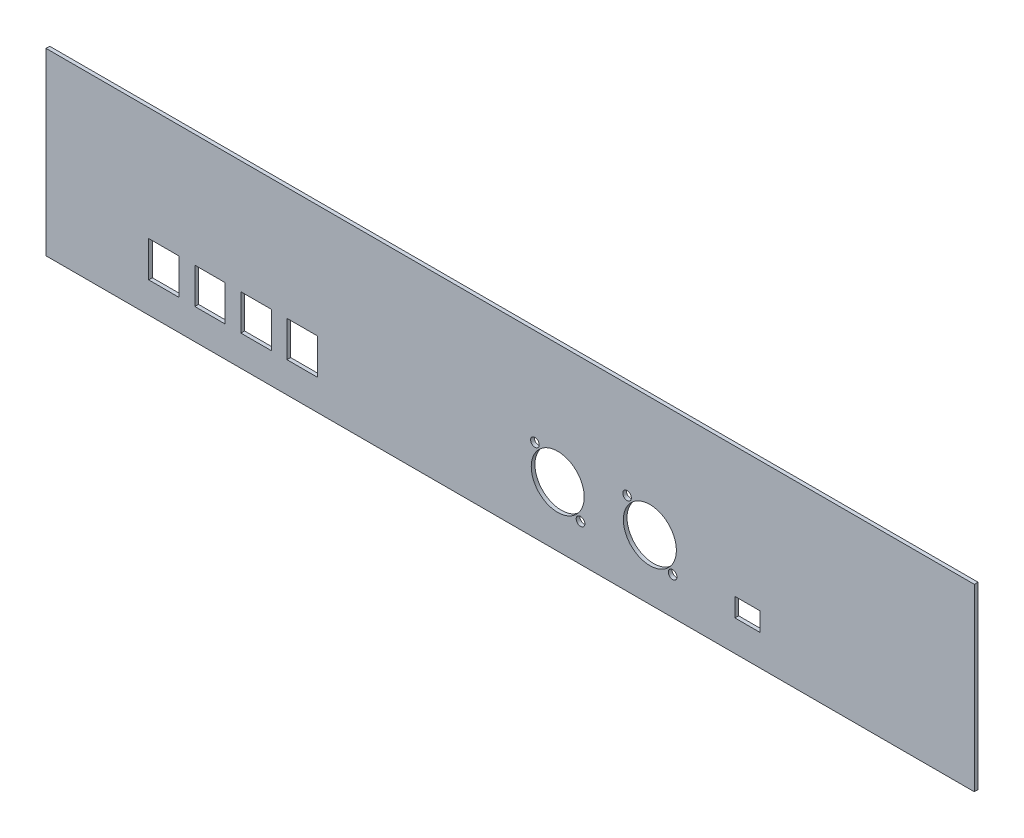
from build123d import *

# Parameters (mm, degrees)
PANEL_W             = 403
PANEL_H             = 78
BOSS_EXTRUDE1_DEPTH = 1.6
XLR4_R              = 11.5
XLR4_R_2            = 1.875
CUT_EXTRUDE2_DEPTH  = 1.6
RJ11_W              = 13.2
RJ11_H              = 15.55
CUT_EXTRUDE3_DEPTH  = 1.6
DC_PORT_W           = 10.85
DC_PORT_H           = 8.1
CUT_EXTRUDE4_DEPTH  = 1.6


with BuildPart() as part:
    # Panel → Boss-Extrude1 (new body)
    with BuildSketch(Plane.XY):
        with Locations((201.5, 39)):
            Rectangle(PANEL_W, PANEL_H)
    extrude(amount=BOSS_EXTRUDE1_DEPTH)

    # XLR4 → Cut-Extrude2 (cut)
    with BuildSketch(Plane.XY):
        with Locations(Location((222.15, 26.1, 0), (0, 0, 180))):
            Circle(XLR4_R)
        with Locations(Location((212.25, 36, 0), (0, 0, 180))):
            Circle(XLR4_R_2)
        with Locations(Location((232.05, 16.2, 0), (0, 0, 180))):
            Circle(XLR4_R_2)
        with Locations(Location((262.15, 26.1, 0), (0, 0, 180))):
            Circle(XLR4_R)
        with Locations(Location((252.25, 36, 0), (0, 0, 180))):
            Circle(XLR4_R_2)
        with Locations(Location((272.05, 16.2, 0), (0, 0, 180))):
            Circle(XLR4_R_2)
    extrude(amount=CUT_EXTRUDE2_DEPTH, mode=Mode.SUBTRACT)

    # RJ11 → Cut-Extrude3 (cut)
    with BuildSketch(Plane.XY):
        with Locations((71.2, 21.025)):
            Rectangle(RJ11_W, RJ11_H)
        with Locations((51.2, 21.025)):
            Rectangle(RJ11_W, RJ11_H)
        with Locations((91.2, 21.025)):
            Rectangle(RJ11_W, RJ11_H)
        with Locations((111.2, 21.025)):
            Rectangle(RJ11_W, RJ11_H)
    extrude(amount=CUT_EXTRUDE3_DEPTH, mode=Mode.SUBTRACT)

    # DC PORT → Cut-Extrude4 (cut)
    with BuildSketch(Plane.XY):
        with Locations((304.525, 17.45)):
            Rectangle(DC_PORT_W, DC_PORT_H)
    extrude(amount=CUT_EXTRUDE4_DEPTH, mode=Mode.SUBTRACT)


solid = part.part
